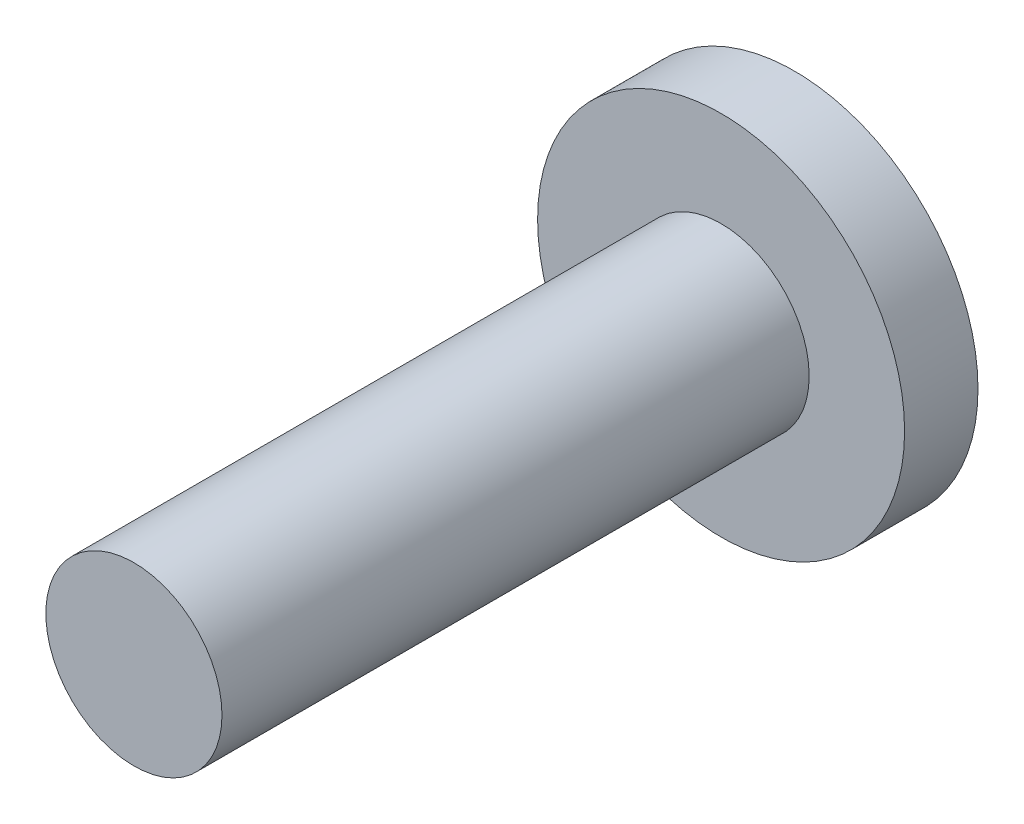
from build123d import *

# Parameters (mm, degrees)
SKETCH_1_R          = 6.25
EXTRUDE_1_DEPTH     = 2.5
SKETCH_2_R          = 3
EXTRUDE_2_DEPTH     = 20
CUT_EXTRUDE_1_DEPTH = 1


with BuildPart() as part:
    # 草图1 → 凸台-拉伸1 (new body)
    with BuildSketch(Plane.XY):
        Circle(SKETCH_1_R)
    extrude(amount=EXTRUDE_1_DEPTH)

    # 草图2 → 凸台-拉伸2 (add)
    with BuildSketch(Plane.XY.offset(2.5)):
        Circle(SKETCH_2_R)
    extrude(amount=EXTRUDE_2_DEPTH)

    # 草图3 → 切除-拉伸1 (cut)
    with BuildSketch(Plane(origin=(0, 0, 0), x_dir=(-1, 0, 0), z_dir=(0, 0, -1))):
        Polygon((2.309401077, 0), (1.154700538, 2), (-1.154700538, 2), (-2.309401077, 0), (-1.154700538, -2), (1.154700538, -2), align=None)
    extrude(amount=-CUT_EXTRUDE_1_DEPTH, mode=Mode.SUBTRACT)


solid = part.part
